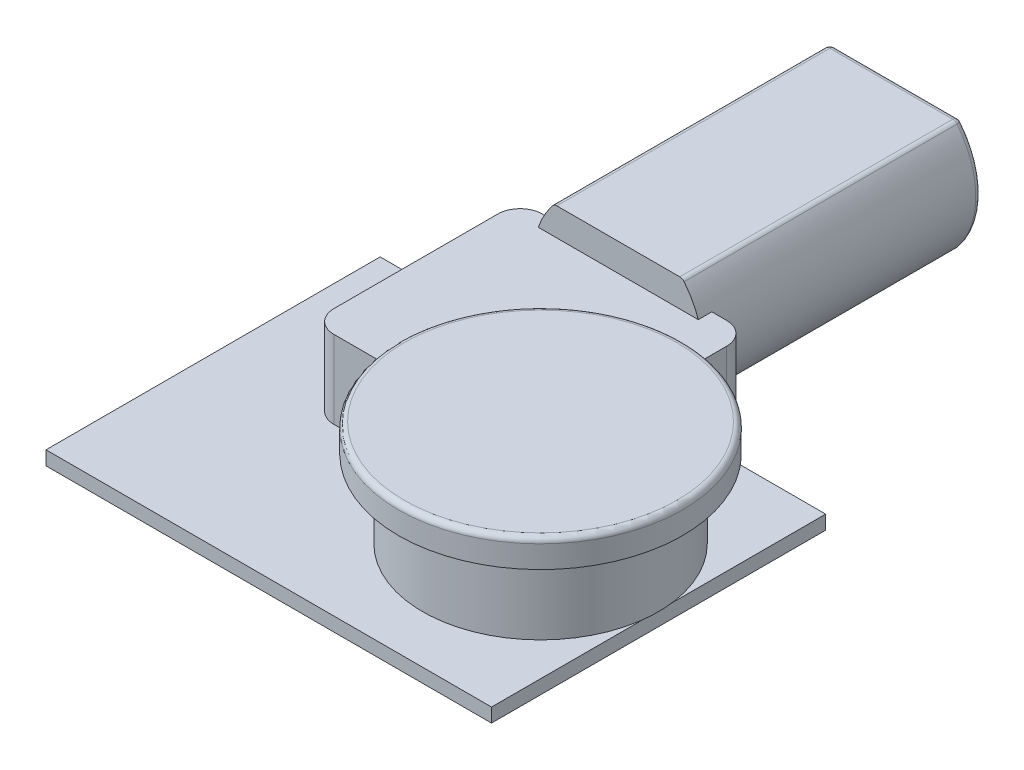
from build123d import *

# Parameters (mm, degrees)
BOSS_EXTRUDE1_DEPTH = 63.5
SKETCH2_R           = 6.985
BOSS_EXTRUDE2_DEPTH = 4.572
FILLET1_R           = 1.27
SKETCH3_R           = 32.385
BOSS_EXTRUDE3_DEPTH = 6.35
BOSS_EXTRUDE4_DEPTH = 17.78
FILLET2_R           = 1.27
SKETCH5_R           = 6.35
SKETCH5_R_2         = 2.159
BOSS_EXTRUDE5_DEPTH = 6.35
SKETCH6_W           = 101.6
SKETCH6_H           = 76.2
SKETCH6_R           = 9.525
BOSS_EXTRUDE6_DEPTH = 3.175


with BuildPart() as part:
    # Sketch1 → Boss-Extrude1 (new body)
    with BuildSketch(Plane.XY):
        with BuildLine():
            Line((-14.605, -12.622931157), (14.605, -12.622931157))
            ThreePointArc((14.605, -12.622931157), (19.304, 0), (14.605, 12.622931157))
            Line((14.605, 12.622931157), (-14.605, 12.622931157))
            ThreePointArc((-14.605, 12.622931157), (-19.304, 0), (-14.605, -12.622931157))
        make_face()
    extrude(amount=BOSS_EXTRUDE1_DEPTH)

    # Sketch2 → Boss-Extrude2 (add)
    with BuildSketch(Plane(origin=(0, 0, 0), x_dir=(-1, 0, 0), z_dir=(0, 0, -1))):
        with Locations(Location((0, 0, 0), (0, 0, 180))):
            Circle(SKETCH2_R)
    extrude(amount=BOSS_EXTRUDE2_DEPTH)

    # Fillet1
    fillet1_edges = [part.edges().sort_by_distance(p)[0] for p in [
        (-6.985, 0, 0),
        (-6.985, 0, -4.572),
        (0, -12.622931157, 0),
        (-19.304, 0, 0),
        (0, 12.622931157, 0),
        (19.304, 0, 0),
        (14.605, -12.622931157, 31.75),
        (-14.605, -12.622931157, 31.75),
        (-14.605, 12.622931157, 31.75),
        (14.605, 12.622931157, 31.75),
    ]]
    fillet(fillet1_edges, radius=FILLET1_R)


with BuildPart() as body_2:
    # Sketch3 → Boss-Extrude3 (new body)
    with BuildSketch(Plane(origin=(0, 12.622931157, 0), x_dir=(1, 0, 0), z_dir=(0, 1, 0))):
        with Locations(Location((26.711998792, -107.95, 0), (0, 0, 270))):
            Circle(SKETCH3_R)
    extrude(amount=-BOSS_EXTRUDE3_DEPTH)

    # Fillet2
    fillet2_edges = [body_2.edges().sort_by_distance(p)[0] for p in [
        (26.711998792, 12.622931157, 75.565),
    ]]
    fillet(fillet2_edges, radius=FILLET2_R)


with BuildPart() as body_3:
    # Sketch4 → Boss-Extrude4 (new body)
    with BuildSketch(Plane.XZ.offset(-6.272931157)):
        with BuildLine():
            Line((26.711998792, 76.392999826), (26.711998792, 65.491798589))
            ThreePointArc((26.711998792, 65.491798589), (25.22410124, 61.89969614), (21.631998792, 60.411798589))
            Line((21.631998792, 60.411798589), (13.553296581, 60.411798589))
            Line((13.553296581, 60.411798589), (-20.414066966, 60.411798589))
            ThreePointArc((-20.414066966, 60.411798589), (-24.006169415, 61.89969614), (-25.494066966, 65.491798589))
            Line((-25.494066966, 65.491798589), (-25.494066966, 102.87))
            ThreePointArc((-25.494066966, 102.87), (-24.006169415, 106.462102448), (-20.414066966, 107.95))
            Line((-20.414066966, 107.95), (-4.845001382, 107.95))
            ThreePointArc((-4.845001382, 107.95), (-1.55069369, 109.162967956), (0.170429094, 112.222623295))
            ThreePointArc((0.170429094, 112.222623295), (45.721341651, 126.959342859), (30.984622087, 81.408430302))
            ThreePointArc((30.984622087, 81.408430302), (27.924966748, 79.687307518), (26.711998792, 76.392999826))
        make_face()
    extrude(amount=BOSS_EXTRUDE4_DEPTH)

    # Sketch5 → Boss-Extrude5 (add)
    with BuildSketch(Plane.XZ.offset(11.507068843)):
        with Locations(Location((26.711998792, 107.95, 0), (0, 0, 270))):
            Circle(SKETCH5_R)
        with Locations(Location((26.711998792, 107.95, 0), (0, 0, 270))):
            Circle(SKETCH5_R_2, mode=Mode.SUBTRACT)
    extrude(amount=BOSS_EXTRUDE5_DEPTH)


with BuildPart() as body_4:
    # Sketch6 → Boss-Extrude6 (new body)
    with BuildSketch(Plane.XZ.offset(17.857068843)):
        with Locations((-3.768001208, 101.345900449)):
            Rectangle(SKETCH6_W, SKETCH6_H)
        with Locations(Location((26.711998792, 107.95, 0), (0, 0, 270))):
            Circle(SKETCH6_R, mode=Mode.SUBTRACT)
    extrude(amount=BOSS_EXTRUDE6_DEPTH)


solid = Compound([part.part, body_2.part, body_3.part, body_4.part])
